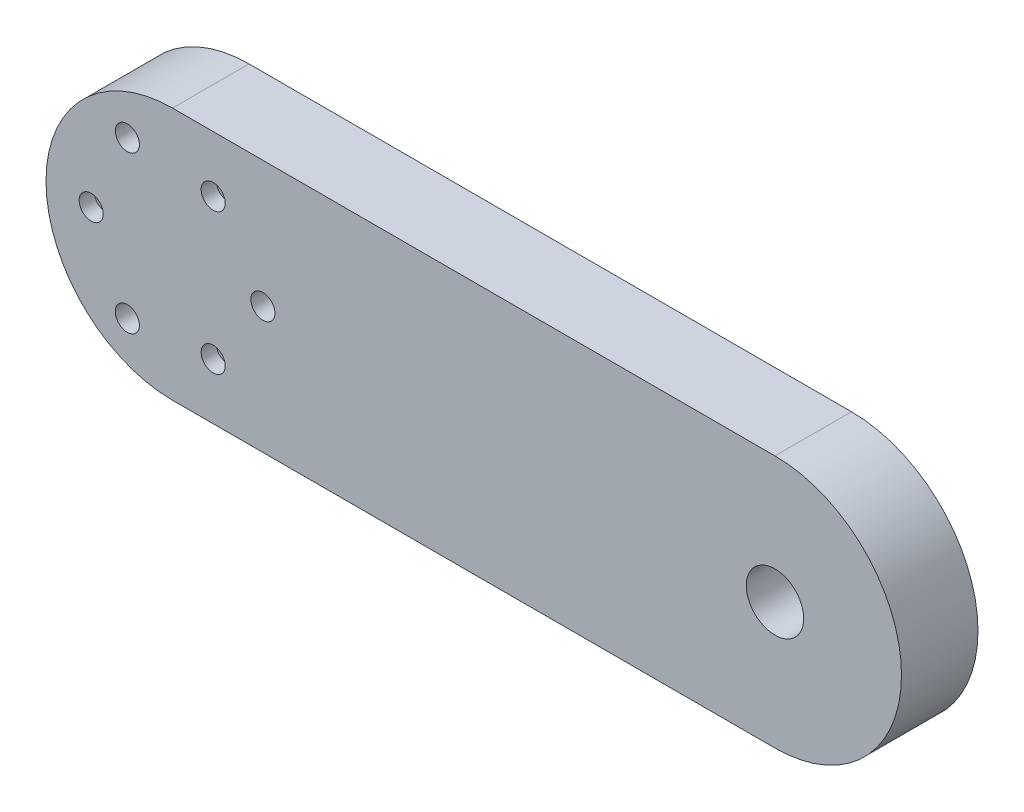
from build123d import *

# Parameters (mm, degrees)
SKETCH1_R           = 4.7625
SKETCH1_R_2         = 2
BOSS_EXTRUDE2_DEPTH = 12.7
SKETCH2_R           = 2
CUT_EXTRUDE1_DEPTH  = 2.5


with BuildPart() as part:
    # Sketch1 → Boss-Extrude2 (new body)
    with BuildSketch(Plane.XY):
        with BuildLine():
            Line((0, 21), (100, 21))
            ThreePointArc((100, 21), (121, 0), (100, -21))
            Line((100, -21), (0, -21))
            ThreePointArc((0, -21), (-21, 0), (0, 21))
        make_face()
        with Locations((100, 0)):
            Circle(SKETCH1_R, mode=Mode.SUBTRACT)
        with Locations((15, 0)):
            Circle(SKETCH1_R_2, mode=Mode.SUBTRACT)
        with Locations((-7.5, -12.990381057)):
            Circle(SKETCH1_R_2, mode=Mode.SUBTRACT)
        with Locations((-7.5, 12.990381057)):
            Circle(SKETCH1_R_2, mode=Mode.SUBTRACT)
    extrude(amount=BOSS_EXTRUDE2_DEPTH)

    # Sketch2 → Cut-Extrude1 (cut)
    with BuildSketch(Plane.XY.offset(12.7)):
        with Locations((-13.5, 0)):
            Circle(SKETCH2_R)
        with Locations((6.75, 11.691342951)):
            Circle(SKETCH2_R)
        with Locations((6.75, -11.691342951)):
            Circle(SKETCH2_R)
    extrude(amount=-CUT_EXTRUDE1_DEPTH, mode=Mode.SUBTRACT)


solid = part.part
